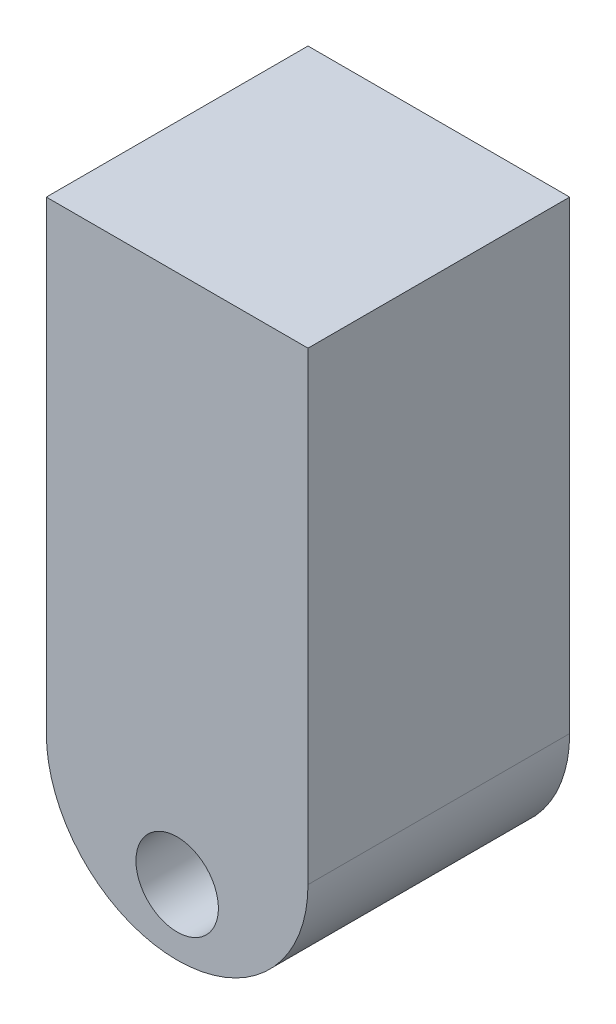
from build123d import *

# Parameters (mm, degrees)
SKETCH1_R           = 3
BOSS_EXTRUDE1_DEPTH = 19.05
SKETCH3_W           = 19.05
SKETCH3_H           = 19.05
BOSS_EXTRUDE2_DEPTH = 25.4


with BuildPart() as part:
    # Sketch1 → Boss-Extrude1 (new body)
    with BuildSketch(Plane.XY):
        with BuildLine():
            Line((-13.962302658, 14.995513055), (5.087697342, 14.995513055))
            Line((5.087697342, 14.995513055), (5.087697342, 6.570840919))
            ThreePointArc((5.087697342, 6.570840919), (-4.437302658, -2.954159081), (-13.962302658, 6.570840919))
            Line((-13.962302658, 6.570840919), (-13.962302658, 14.995513055))
        make_face()
        with Locations(Location((-4.437302658, 1.820065848, 0), (0, 0, 180))):
            Circle(SKETCH1_R, mode=Mode.SUBTRACT)
    extrude(amount=BOSS_EXTRUDE1_DEPTH)

    # Sketch3 → Boss-Extrude2 (add)
    with BuildSketch(Plane(origin=(0, 14.995513055, 0), x_dir=(1, 0, 0), z_dir=(0, 1, 0))):
        with Locations((-4.437302658, -9.525)):
            Rectangle(SKETCH3_W, SKETCH3_H)
    extrude(amount=BOSS_EXTRUDE2_DEPTH)


solid = part.part
